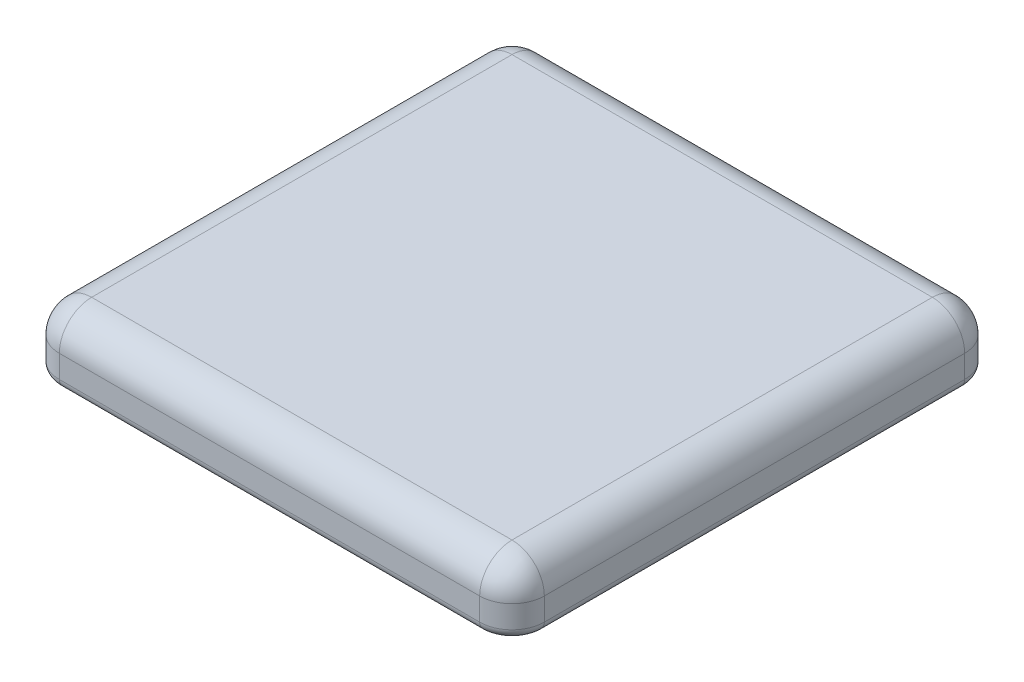
from build123d import *

# Parameters (mm, degrees)
SKETCH_1_W      = 15
SKETCH_1_H      = 15
EXTRUDE_1_DEPTH = 2
FILLET_1_R      = 1
SKETCH_2_W      = 1.2
SKETCH_2_H      = 3
EXTRUDE_2_DEPTH = 4
FILLET_2_R      = 0.3


with BuildPart() as part:
    # 草图1 → 凸台-拉伸1 (new body)
    with BuildSketch(Plane(origin=(0, 0, 0), x_dir=(1, 0, 0), z_dir=(0, 1, 0))):
        with Locations((30.528568239, 7.5)):
            Rectangle(SKETCH_1_W, SKETCH_1_H)
    extrude(amount=EXTRUDE_1_DEPTH)

    # 圆角1
    fillet_1_edges = [part.edges().sort_by_distance(p)[0] for p in [
        (38.028568239, 2, -7.5),
        (30.528568239, 2, -15),
        (23.028568239, 2, -7.5),
        (23.028568239, 1, -15),
        (38.028568239, 1, -15),
        (38.028568239, 1, 0),
        (23.028568239, 1, 0),
        (30.528568239, 2, 0),
    ]]
    fillet(fillet_1_edges, radius=FILLET_1_R)

    # 草图2 → 凸台-拉伸2 (add)
    with BuildSketch(Plane.XZ):
        with Locations((33.378568239, -7.5)):
            Rectangle(SKETCH_2_W, SKETCH_2_H)
        with Locations((27.678568239, -7.5)):
            Rectangle(SKETCH_2_W, SKETCH_2_H)
    extrude(amount=EXTRUDE_2_DEPTH)

    # 圆角2
    fillet_2_edges = [part.edges().sort_by_distance(p)[0] for p in [
        (30.528568239, 0, 0),
        (38.028568239, 0, -7.5),
        (23.028568239, 0, -7.5),
        (30.528568239, 0, -15),
        (23.321461458, 0, -0.292893219),
        (37.73567502, 0, -0.292893219),
        (23.321461458, 0, -14.707106781),
        (37.73567502, 0, -14.707106781),
        (28.278568239, 0, -7.5),
        (27.678568239, 0, -6),
        (27.078568239, 0, -7.5),
        (27.678568239, 0, -9),
        (28.278568239, -4, -7.5),
        (27.678568239, -4, -6),
        (27.078568239, -4, -7.5),
        (27.678568239, -4, -9),
        (33.978568239, 0, -7.5),
        (33.378568239, 0, -6),
        (32.778568239, 0, -7.5),
        (33.378568239, 0, -9),
        (33.978568239, -4, -7.5),
        (33.378568239, -4, -6),
        (32.778568239, -4, -7.5),
        (33.378568239, -4, -9),
    ]]
    fillet(fillet_2_edges, radius=FILLET_2_R)


solid = part.part
